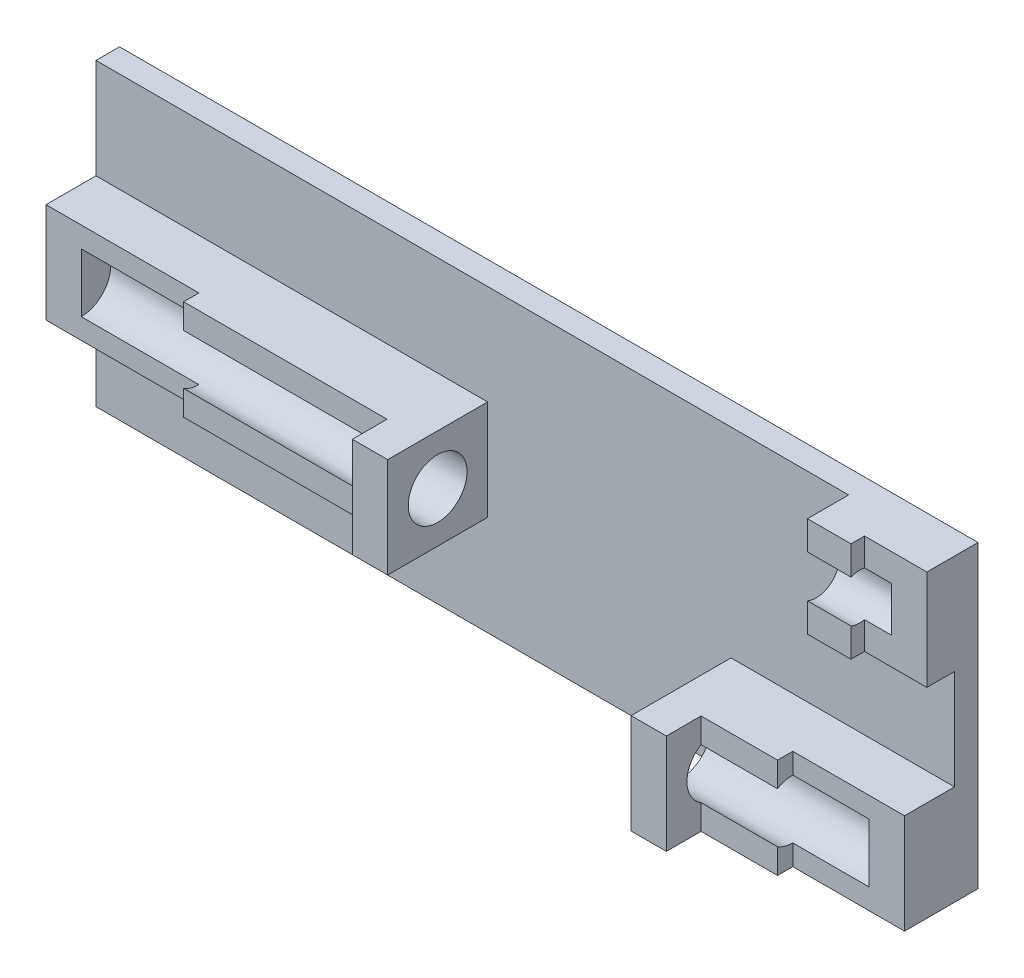
from build123d import *

# Parameters (mm, degrees)
CROQUIS1_W              = 73
CROQUIS1_H              = 25.5
SALIENTE_EXTRUIR1_DEPTH = 2
CROQUIS2_W              = 3
CROQUIS2_H              = 8.5
SALIENTE_EXTRUIR2_DEPTH = 8.5
CROQUIS4_W              = 13
CROQUIS4_H              = 8.5
CROQUIS4_W_2            = 27.3
SALIENTE_EXTRUIR3_DEPTH = 6.05
CORTAR_EXTRUIR1_START   = -16
CROQUIS5_R              = 2.5
CORTAR_EXTRUIR1_DEPTH   = 16
CORTAR_EXTRUIR2_START   = -30.3
CROQUIS6_R              = 2.5
CORTAR_EXTRUIR2_DEPTH   = 30.3
CROQUIS7_W              = 10
CROQUIS7_H              = 8.5
CROQUIS7_W_2            = 6.5
CORTAR_EXTRUIR3_DEPTH   = 1.8
CROQUIS8_W              = 3
CROQUIS8_H              = 8.5
SALIENTE_EXTRUIR4_DEPTH = 4.85
CROQUIS9_R              = 1.95
CORTAR_EXTRUIR4_DEPTH   = 6
CORTAR_EXTRUIR5_START   = -3.65
CROQUIS10_W             = 3
CROQUIS10_H             = 8.5
CORTAR_EXTRUIR5_DEPTH   = 3.65
CORTAR_EXTRUIR6_START   = -4.25
CROQUIS11_W             = 3
CROQUIS11_H             = 8.5
CORTAR_EXTRUIR6_DEPTH   = 4.25
CROQUIS12_W             = 17.3
CROQUIS12_H             = 8.5
CROQUIS12_W_2           = 6.5
CORTAR_EXTRUIR7_DEPTH   = 0.5
CROQUIS13_W             = 5.3
CROQUIS13_H             = 8.5
CORTAR_EXTRUIR8_DEPTH   = 2.5
CROQUIS15_W             = 4.5
CROQUIS15_H             = 8.5
CORTAR_EXTRUIR9_DEPTH   = 5


with BuildPart() as part:
    # Croquis1 → Saliente-Extruir1 (new body)
    with BuildSketch(Plane.XY):
        with Locations((-50.046391753, 8.196735395)):
            Rectangle(CROQUIS1_W, CROQUIS1_H)
    extrude(amount=SALIENTE_EXTRUIR1_DEPTH)

    # Croquis2 → Saliente-Extruir2 (add)
    with BuildSketch(Plane.XY.offset(2)):
        with Locations((-15.046391753, 16.696735395)):
            Rectangle(CROQUIS2_W, CROQUIS2_H)
        with Locations((-15.046391753, -0.303264605)):
            Rectangle(CROQUIS2_W, CROQUIS2_H)
        with Locations((-85.046391753, 8.196735395)):
            Rectangle(CROQUIS2_W, CROQUIS2_H)
        with Locations((-21.046391753, 16.696735395)):
            Rectangle(CROQUIS2_W, CROQUIS2_H)
        with Locations((-31.046391753, -0.303264605)):
            Rectangle(CROQUIS2_W, CROQUIS2_H)
        with Locations((-54.746391753, 8.196735395)):
            Rectangle(CROQUIS2_W, CROQUIS2_H)
    extrude(amount=SALIENTE_EXTRUIR2_DEPTH)

    # Croquis4 → Saliente-Extruir3 (add)
    with BuildSketch(Plane.XY.offset(2)):
        with Locations((-23.046391753, -0.303264605)):
            Rectangle(CROQUIS4_W, CROQUIS4_H)
        with Locations((-69.896391753, 8.196735395)):
            Rectangle(CROQUIS4_W_2, CROQUIS4_H)
    extrude(amount=SALIENTE_EXTRUIR3_DEPTH)

    # Croquis5 → Cortar-Extruir1 (cut)
    with BuildSketch(Plane.ZY.offset(32.546391753).offset(CORTAR_EXTRUIR1_START)):
        with Locations((6.25, -0.303264605)):
            Circle(CROQUIS5_R)
    extrude(amount=CORTAR_EXTRUIR1_DEPTH, mode=Mode.SUBTRACT)

    # Croquis6 → Cortar-Extruir2 (cut)
    with BuildSketch(Plane(origin=(-53.246391753, 0, 0), x_dir=(0, 0, -1), z_dir=(1, 0, 0)).offset(CORTAR_EXTRUIR2_START)):
        with Locations((-6.25, 8.196735395)):
            Circle(CROQUIS6_R)
    extrude(amount=CORTAR_EXTRUIR2_DEPTH, mode=Mode.SUBTRACT)

    # Croquis7 → Cortar-Extruir3 (cut)
    with BuildSketch(Plane.XY.offset(8.05)):
        with Locations((-78.546391753, 8.196735395)):
            Rectangle(CROQUIS7_W, CROQUIS7_H)
        with Locations((-19.796391753, -0.303264605)):
            Rectangle(CROQUIS7_W_2, CROQUIS7_H)
    extrude(amount=-CORTAR_EXTRUIR3_DEPTH, mode=Mode.SUBTRACT)

    # Croquis8 → Saliente-Extruir4 (add)
    with BuildSketch(Plane.XY.offset(2)):
        with Locations((-18.046391753, 16.696735395)):
            Rectangle(CROQUIS8_W, CROQUIS8_H)
    extrude(amount=SALIENTE_EXTRUIR4_DEPTH)

    # Croquis9 → Cortar-Extruir4 (cut)
    with BuildSketch(Plane.ZY.offset(22.546391753)):
        with Locations((4.75, 16.696735395)):
            Circle(CROQUIS9_R)
    extrude(amount=-CORTAR_EXTRUIR4_DEPTH, mode=Mode.SUBTRACT)

    # Croquis10 → Cortar-Extruir5 (cut)
    with BuildSketch(Plane.XY.offset(10.5).offset(CORTAR_EXTRUIR5_START)):
        with Locations((-15.046391753, 16.696735395)):
            Rectangle(CROQUIS10_W, CROQUIS10_H)
    extrude(amount=CORTAR_EXTRUIR5_DEPTH, mode=Mode.SUBTRACT)

    # Croquis11 → Cortar-Extruir6 (cut)
    with BuildSketch(Plane.XY.offset(10.5).offset(CORTAR_EXTRUIR6_START)):
        with Locations((-15.046391753, -0.303264605)):
            Rectangle(CROQUIS11_W, CROQUIS11_H)
        with Locations((-85.046391753, 8.196735395)):
            Rectangle(CROQUIS11_W, CROQUIS11_H)
    extrude(amount=CORTAR_EXTRUIR6_DEPTH, mode=Mode.SUBTRACT)

    # Croquis12 → Cortar-Extruir7 (cut)
    with BuildSketch(Plane.XY.offset(8.05)):
        with Locations((-64.896391753, 8.196735395)):
            Rectangle(CROQUIS12_W, CROQUIS12_H)
        with Locations((-26.296391753, -0.303264605)):
            Rectangle(CROQUIS12_W_2, CROQUIS12_H)
    extrude(amount=-CORTAR_EXTRUIR7_DEPTH, mode=Mode.SUBTRACT)

    # Croquis13 → Cortar-Extruir8 (cut)
    with BuildSketch(Plane.XY.offset(6.85)):
        with Locations((-16.196391753, 16.696735395)):
            Rectangle(CROQUIS13_W, CROQUIS13_H)
    extrude(amount=-CORTAR_EXTRUIR8_DEPTH, mode=Mode.SUBTRACT)

    # Croquis15 → Cortar-Extruir9 (cut)
    with BuildSketch(Plane.XY.offset(10.5)):
        with Locations((-20.296391753, 16.696735395)):
            Rectangle(CROQUIS15_W, CROQUIS15_H)
    extrude(amount=-CORTAR_EXTRUIR9_DEPTH, mode=Mode.SUBTRACT)


solid = part.part
